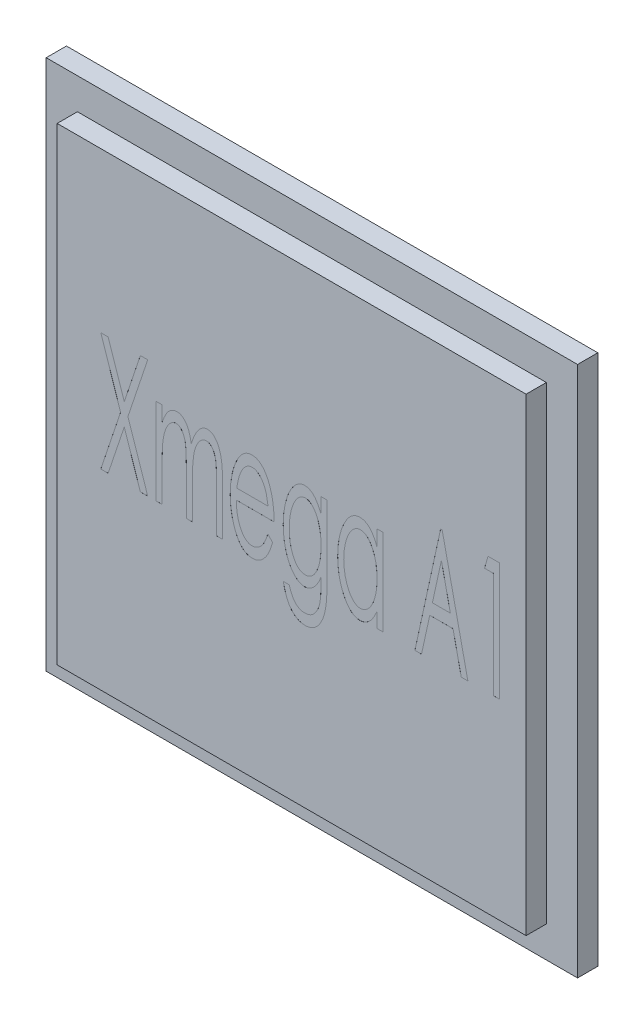
from build123d import *

# Parameters (mm, degrees)
SKICA1_W                 = 13.9
SKICA1_H                 = 13.9
P_IDAT_VYSUNUT_M1_DEPTH  = 1.2
ODEBRAT_VYSUNUT_M1_DEPTH = 0.001
SKICA4_W                 = 15.75
SKICA4_H                 = 15.75
SKICA4_W_2               = 13.9
SKICA4_H_2               = 13.9
P_IDAT_VYSUNUT_M3_DEPTH  = 0.6


with BuildPart() as part:
    # Skica1 → Přidat vysunutím1 (new body)
    with BuildSketch(Plane.XY):
        Rectangle(SKICA1_W, SKICA1_H)
    extrude(amount=P_IDAT_VYSUNUT_M1_DEPTH)

    # Skica2 → Odebrat vysunutím1 (cut)
    # profile 1 of 7: a face of its own
    with BuildSketch(Plane.XY.offset(1.2)):
        Polygon((-5.657339525, 2.224423239), (-5.439290647, 2.224423239), (-4.961826704, 0.799743751), (-4.484362762, 2.224423239), (-4.266313884, 2.224423239), (-4.852451704, 0.474423239), (-4.266313884, -1.275576761), (-4.484362762, -1.275576761), (-4.961826704, 0.149102726), (-5.439290647, -1.275576761), (-5.657339525, -1.275576761), (-5.070500583, 0.474423239), align=None)
    # profile 2 of 7: a face of its own
    with BuildSketch(Plane.XY.offset(1.2)):
        with BuildLine():
            Line((-4.019519012, 1.282115546), (-3.840031833, 1.282115546))
            Line((-3.840031833, 1.282115546), (-3.840031833, 0.837604328))
            add(Edge.make_bspline(
                [(-3.840031833, 0.837604328), (-3.825894466, 0.876177676), (-3.799336233, 0.948640953), (-3.753371331, 1.04665495), (-3.708878302, 1.129507622), (-3.674372124, 1.175873554), (-3.658441288, 1.197279809)],
                knots=[0, 0, 0, 0, 1.217816216, 2.287770118, 3.209496512, 4, 4, 4, 4], degree=3))
            add(Edge.make_bspline(
                [(-3.658441288, 1.197279809), (-3.63759457, 1.217028599), (-3.59781794, 1.254710324), (-3.53027268, 1.296083888), (-3.460411369, 1.321741182), (-3.412782742, 1.325250513), (-3.389210519, 1.326987341)],
                knots=[0, 0, 0, 0, 1.120991578, 2.138910614, 3.078914958, 4, 4, 4, 4], degree=3))
            add(Edge.make_bspline(
                [(-3.389210519, 1.326987341), (-3.373475752, 1.325898128), (-3.341698894, 1.323698429), (-3.2947333, 1.310162074), (-3.249879156, 1.285928981), (-3.206685171, 1.253537508), (-3.165837036, 1.213845973), (-3.128293998, 1.167823416), (-3.095242019, 1.11551161), (-3.066321996, 1.055807911), (-3.03903517, 0.987090192), (-3.015138114, 0.906270274), (-2.992715126, 0.812374405), (-2.980142298, 0.745121675), (-2.973445294, 0.70929904)],
                knots=[0, 0, 0, 0, 0.70497467, 1.423718626, 2.167988911, 2.97590154, 3.834418343, 4.712110969, 5.629520406, 6.598314936, 7.678802742, 8.936786955, 10.368358232, 12, 12, 12, 12], degree=3))
            add(Edge.make_bspline(
                [(-2.973445294, 0.70929904), (-2.959218782, 0.756982823), (-2.932245592, 0.847390348), (-2.88267354, 0.972275962), (-2.827548523, 1.07894444), (-2.76766526, 1.167639393), (-2.70294897, 1.237516157), (-2.635397876, 1.288822957), (-2.563841792, 1.321050295), (-2.514504009, 1.32503727), (-2.490372377, 1.326987341)],
                knots=[0, 0, 0, 0, 1.430898735, 2.712956173, 3.858598611, 4.878593333, 5.782223817, 6.584917614, 7.307868261, 8, 8, 8, 8], degree=3))
            add(Edge.make_bspline(
                [(-2.490372377, 1.326987341), (-2.46819168, 1.325297807), (-2.423626211, 1.321903193), (-2.359219648, 1.295988331), (-2.300987539, 1.251806236), (-2.247160101, 1.19283831), (-2.198283844, 1.119587341), (-2.156560774, 1.032560304), (-2.121716514, 0.932521707), (-2.09838612, 0.840101313), (-2.082898081, 0.757427487), (-2.07237125, 0.686823277), (-2.064261103, 0.608662875), (-2.057285794, 0.523336331), (-2.051787686, 0.430529991), (-2.047428831, 0.330263669), (-2.045590712, 0.222493878), (-2.045306566, 0.148168207), (-2.045160038, 0.109839905)],
                knots=[0, 0, 0, 0, 0.756463087, 1.519885966, 2.330984414, 3.234758128, 4.235496569, 5.327959897, 6.52219358, 7.848426635, 8.57957358, 9.394668963, 10.285911105, 11.263066096, 12.318715349, 13.461245202, 14.690813573, 16, 16, 16, 16], degree=3))
            Line((-2.045160038, 0.109839905), (-2.045160038, -1.275576761))
            Line((-2.045160038, -1.275576761), (-2.224647217, -1.275576761))
            Line((-2.224647217, -1.275576761), (-2.224647217, 0.111242149))
            add(Edge.make_bspline(
                [(-2.224647217, 0.111242149), (-2.224817833, 0.143961908), (-2.225145674, 0.206833442), (-2.226619023, 0.29704584), (-2.228409986, 0.37933643), (-2.232031997, 0.453422364), (-2.236234622, 0.519567169), (-2.24079131, 0.577840011), (-2.247111541, 0.628099002), (-2.256134461, 0.683561692), (-2.270920334, 0.744285885), (-2.292639363, 0.810468988), (-2.321066527, 0.868896955), (-2.354238568, 0.918936119), (-2.391202109, 0.96082324), (-2.433054395, 0.990806828), (-2.47899912, 1.010040289), (-2.511222529, 1.011928894), (-2.527531833, 1.012884777)],
                knots=[0, 0, 0, 0, 1.51836297, 2.917558436, 4.186860745, 5.337727298, 6.359248196, 7.262593179, 8.049522409, 8.709208536, 9.869236563, 10.946135496, 11.935605254, 12.874073121, 13.726161472, 14.511594637, 15.246670199, 16, 16, 16, 16], degree=3))
            add(Edge.make_bspline(
                [(-2.527531833, 1.012884777), (-2.547710855, 1.01134642), (-2.588921681, 1.008204693), (-2.647228539, 0.978515454), (-2.70235493, 0.933516605), (-2.752975383, 0.871380744), (-2.799664925, 0.795771972), (-2.839517541, 0.707285215), (-2.871725884, 0.607185277), (-2.894326091, 0.515532916), (-2.907540724, 0.432727759), (-2.91767075, 0.359869833), (-2.924940208, 0.277016962), (-2.930985944, 0.184428283), (-2.936986072, 0.082088741), (-2.940043076, -0.03013553), (-2.942257384, -0.152136666), (-2.942480217, -0.236746668), (-2.942595935, -0.280684934)],
                knots=[0, 0, 0, 0, 0.660002353, 1.34789691, 2.107969646, 2.991979148, 3.96914392, 5.025409628, 6.175424129, 7.424845589, 8.126354717, 8.933170354, 9.844345944, 10.861583212, 11.98578703, 13.216546376, 14.554542928, 16, 16, 16, 16], degree=3))
            Line((-2.942595935, -0.280684934), (-2.942595935, -1.275576761))
            Line((-2.942595935, -1.275576761), (-3.122083115, -1.275576761))
            Line((-3.122083115, -1.275576761), (-3.122083115, 0.025004168))
            add(Edge.make_bspline(
                [(-3.122083115, 0.025004168), (-3.122261522, 0.061696657), (-3.122604711, 0.132279648), (-3.123977044, 0.233478943), (-3.126080332, 0.325564801), (-3.12869218, 0.408317969), (-3.132558487, 0.481760734), (-3.138757355, 0.545946346), (-3.143510917, 0.601046181), (-3.153119517, 0.66099364), (-3.166250626, 0.726551738), (-3.189722025, 0.79685332), (-3.217379598, 0.859388589), (-3.250991808, 0.912683928), (-3.288431668, 0.957055374), (-3.330760701, 0.989497496), (-3.377582116, 1.009178718), (-3.410067932, 1.01164643), (-3.426369974, 1.012884777)],
                knots=[0, 0, 0, 0, 1.574861193, 3.029459675, 4.343833698, 5.52814318, 6.583091089, 7.499410718, 8.295893451, 8.955563666, 10.104512628, 11.160794949, 12.130411979, 13.03206512, 13.856786337, 14.609093303, 15.302014803, 16, 16, 16, 16], degree=3))
            add(Edge.make_bspline(
                [(-3.426369974, 1.012884777), (-3.445589885, 1.011238905), (-3.485285758, 1.0078396), (-3.542013777, 0.979110921), (-3.595870075, 0.935017332), (-3.646407022, 0.874730588), (-3.69299365, 0.800749221), (-3.732255252, 0.713534908), (-3.767049287, 0.615471758), (-3.789084506, 0.524792977), (-3.803642279, 0.444243231), (-3.813448547, 0.375014818), (-3.821624191, 0.298069945), (-3.828825924, 0.213465912), (-3.833149517, 0.121073925), (-3.837829033, 0.021306814), (-3.839590388, -0.086468188), (-3.839881037, -0.160793178), (-3.840031833, -0.199354806)],
                knots=[0, 0, 0, 0, 0.667901347, 1.379451074, 2.174339452, 3.088250632, 4.111091931, 5.216854925, 6.419016473, 7.738532864, 8.468087668, 9.275556869, 10.178113764, 11.168435705, 12.23848396, 13.405914129, 14.654124622, 16, 16, 16, 16], degree=3))
            Line((-3.840031833, -0.199354806), (-3.840031833, -1.275576761))
            Line((-3.840031833, -1.275576761), (-4.019519012, -1.275576761))
            Line((-4.019519012, -1.275576761), (-4.019519012, 1.282115546))
        make_face()
    # profile 3 of 7: a face of its own
    with BuildSketch(Plane.XY.offset(1.2)):
        with BuildLine():
            Line((-0.703914044, -0.467884454), (-0.564390807, -0.614418909))
            add(Edge.make_bspline(
                [(-0.564390807, -0.614418909), (-0.575703412, -0.653562624), (-0.597339871, -0.728428797), (-0.63433389, -0.834273223), (-0.674633578, -0.92801527), (-0.717757801, -1.010149823), (-0.762626683, -1.082167519), (-0.811445412, -1.143843245), (-0.861763258, -1.198081776), (-0.915909252, -1.242570484), (-0.973205099, -1.277497436), (-1.034110299, -1.302705414), (-1.098857585, -1.317658708), (-1.143440831, -1.319512485), (-1.165953307, -1.320448556)],
                knots=[0, 0, 0, 0, 1.469774626, 2.811087318, 4.042166936, 5.147176912, 6.155303339, 7.098135502, 7.980804388, 8.819619538, 9.617788822, 10.392823073, 11.188450055, 12, 12, 12, 12], degree=3))
            add(Edge.make_bspline(
                [(-1.165953307, -1.320448556), (-1.191081157, -1.319273375), (-1.240674319, -1.316953999), (-1.312543134, -1.297313706), (-1.379742059, -1.264914013), (-1.442700778, -1.220047785), (-1.501204892, -1.162307455), (-1.55523564, -1.092057737), (-1.604961683, -1.00935605), (-1.649374152, -0.915500266), (-1.689490811, -0.814180702), (-1.724316012, -0.707995044), (-1.754942704, -0.598689612), (-1.778227282, -0.485641205), (-1.797164693, -0.369859203), (-1.811619183, -0.250849539), (-1.818964509, -0.128402618), (-1.820184633, -0.045583593), (-1.820801063, -0.003741825)],
                knots=[0, 0, 0, 0, 0.751038303, 1.482274219, 2.211198371, 2.973871351, 3.785035177, 4.662261782, 5.619491828, 6.667478129, 7.76628157, 8.878823215, 10.010633725, 11.161560532, 12.33097756, 13.521271466, 14.747698584, 16, 16, 16, 16], degree=3))
            add(Edge.make_bspline(
                [(-1.820801063, -0.003741825), (-1.820451152, 0.035530981), (-1.819759081, 0.113206608), (-1.812629117, 0.228083454), (-1.80058701, 0.339858107), (-1.784537206, 0.448401521), (-1.764441921, 0.553792624), (-1.73901992, 0.65578934), (-1.709140619, 0.754587357), (-1.68534636, 0.818553821), (-1.673565486, 0.850224521)],
                knots=[0, 0, 0, 0, 1.081354805, 2.138755058, 3.167849101, 4.176290871, 5.159507986, 6.121001866, 7.069681469, 8, 8, 8, 8], degree=3))
            add(Edge.make_bspline(
                [(-1.673565486, 0.850224521), (-1.658060862, 0.887659511), (-1.628427696, 0.959207017), (-1.576424027, 1.057002611), (-1.518979101, 1.139183671), (-1.459133336, 1.20788406), (-1.393445003, 1.260676362), (-1.324414716, 1.299723822), (-1.250055837, 1.32230525), (-1.199284137, 1.325417138), (-1.173665647, 1.326987341)],
                knots=[0, 0, 0, 0, 1.322197472, 2.527045748, 3.606318956, 4.589521203, 5.490186208, 6.34374623, 7.164284008, 8, 8, 8, 8], degree=3))
            add(Edge.make_bspline(
                [(-1.173665647, 1.326987341), (-1.147293296, 1.325611453), (-1.094834376, 1.322874586), (-1.018859798, 1.297224829), (-0.947144326, 1.257330145), (-0.879700817, 1.201513955), (-0.817890726, 1.129026813), (-0.76014333, 1.041310044), (-0.705062844, 0.93874797), (-0.674870088, 0.8631909), (-0.659042249, 0.823581893)],
                knots=[0, 0, 0, 0, 0.823440567, 1.637957963, 2.48296191, 3.382350809, 4.36252078, 5.454315555, 6.665485104, 8, 8, 8, 8], degree=3))
            add(Edge.make_bspline(
                [(-0.659042249, 0.823581893), (-0.647936141, 0.793084861), (-0.625336883, 0.731027992), (-0.597444207, 0.633569263), (-0.573808184, 0.530793379), (-0.554244871, 0.422461289), (-0.538615967, 0.308806239), (-0.528745757, 0.189425708), (-0.521275269, 0.064591898), (-0.520112688, -0.020556837), (-0.519519012, -0.0640383)],
                knots=[0, 0, 0, 0, 0.862103675, 1.754251248, 2.691108883, 3.663011642, 4.678144778, 5.737819903, 6.844810799, 8, 8, 8, 8], degree=3))
            Line((-0.519519012, -0.0640383), (-1.641313884, -0.0640383))
            add(Edge.make_bspline(
                [(-1.641313884, -0.0640383), (-1.640803821, -0.097714288), (-1.639803588, -0.163752978), (-1.631148848, -0.260241083), (-1.621674928, -0.352403117), (-1.605618767, -0.439294631), (-1.587344657, -0.521989067), (-1.562915751, -0.59935118), (-1.536809806, -0.673131949), (-1.505413281, -0.740932881), (-1.471336883, -0.802676508), (-1.435039114, -0.856700597), (-1.397212114, -0.902995928), (-1.357024826, -0.940678845), (-1.314589971, -0.970109196), (-1.269667013, -0.990544252), (-1.223044866, -1.003961143), (-1.191048797, -1.00555161), (-1.17506789, -1.006345992)],
                knots=[0, 0, 0, 0, 1.414313561, 2.773472163, 4.06801243, 5.30443612, 6.48331242, 7.623069609, 8.710148246, 9.768882371, 10.757758178, 11.669971891, 12.499622512, 13.26377558, 13.977242447, 14.658150177, 15.329793424, 16, 16, 16, 16], degree=3))
            add(Edge.make_bspline(
                [(-1.17506789, -1.006345992), (-1.159343284, -1.005716694), (-1.127724296, -1.004451303), (-1.080853856, -0.992578), (-1.034996495, -0.973324984), (-0.990255841, -0.947072898), (-0.946908891, -0.915445219), (-0.907909106, -0.876794062), (-0.871028971, -0.834770405), (-0.836902929, -0.786049413), (-0.804630369, -0.726596672), (-0.771593388, -0.654150592), (-0.737101524, -0.566340442), (-0.715530636, -0.502346938), (-0.703914044, -0.467884454)],
                knots=[0, 0, 0, 0, 0.738465075, 1.484903234, 2.258522336, 3.071061432, 3.91960142, 4.774665461, 5.647350008, 6.546892649, 7.56535417, 8.824326256, 10.289801275, 12, 12, 12, 12], degree=3))
        make_face()
        with BuildLine():
            add(Edge.make_bspline(
                [(-0.699006192, 0.250064264), (-0.704758733, 0.29147865), (-0.715682561, 0.370122787), (-0.7362076, 0.481264656), (-0.76126769, 0.578964787), (-0.790139229, 0.664626389), (-0.82338067, 0.740005768), (-0.861115389, 0.807350786), (-0.904824747, 0.866396473), (-0.952317269, 0.91737961), (-1.001943409, 0.96041784), (-1.055420442, 0.989750227), (-1.109602511, 1.009980028), (-1.146852102, 1.011924347), (-1.165252185, 1.012884777)],
                knots=[0, 0, 0, 0, 1.557983534, 2.958543775, 4.20899479, 5.313354295, 6.323151934, 7.274795459, 8.184011725, 9.052834006, 9.869040623, 10.617635379, 11.317156976, 12, 12, 12, 12], degree=3))
            add(Edge.make_bspline(
                [(-1.165252185, 1.012884777), (-1.180274467, 1.012256249), (-1.210280707, 1.011000796), (-1.25429857, 0.999375818), (-1.296191498, 0.979603764), (-1.337472891, 0.953838113), (-1.375511306, 0.918806909), (-1.412675499, 0.877312714), (-1.448210888, 0.828477195), (-1.46918106, 0.792011616), (-1.480055871, 0.773101123)],
                knots=[0, 0, 0, 0, 0.865497469, 1.728786899, 2.60358039, 3.531120603, 4.52424669, 5.574483609, 6.742164244, 8, 8, 8, 8], degree=3))
            add(Edge.make_bspline(
                [(-1.480055871, 0.773101123), (-1.487992182, 0.757781916), (-1.504557513, 0.725806387), (-1.525813537, 0.673821011), (-1.546280056, 0.616778343), (-1.565214408, 0.554060065), (-1.58238774, 0.485677258), (-1.598720628, 0.412102229), (-1.612461385, 0.33293054), (-1.620842839, 0.278357083), (-1.625188083, 0.250064264)],
                knots=[0, 0, 0, 0, 0.758823364, 1.583879516, 2.4686208, 3.425043348, 4.465103222, 5.570473885, 6.74044733, 8, 8, 8, 8], degree=3))
            Line((-1.625188083, 0.250064264), (-0.699006192, 0.250064264))
        make_face(mode=Mode.SUBTRACT)
    # profile 4 of 7: a face of its own
    with BuildSketch(Plane.XY.offset(1.2)):
        with BuildLine():
            Line((0.871506629, 1.282115546), (1.050993808, 1.282115546))
            Line((1.050993808, 1.282115546), (1.050993808, -0.74763205))
            add(Edge.make_bspline(
                [(1.050993808, -0.74763205), (1.050866885, -0.790868627), (1.050621942, -0.874309061), (1.048543153, -0.994915571), (1.045009802, -1.106400525), (1.040532879, -1.209061163), (1.033094846, -1.302498212), (1.02597323, -1.387229682), (1.016030443, -1.462695197), (1.00833072, -1.510001863), (1.00471977, -1.532187338)],
                knots=[0, 0, 0, 0, 1.318820306, 2.545135331, 3.67915165, 4.721130733, 5.679026657, 6.538051681, 7.314387987, 8, 8, 8, 8], degree=3))
            add(Edge.make_bspline(
                [(1.00471977, -1.532187338), (0.999169073, -1.56076444), (0.988375415, -1.616334299), (0.967747185, -1.69652344), (0.945022781, -1.771885446), (0.917985541, -1.841807121), (0.889623684, -1.907532066), (0.857318916, -1.968074343), (0.821569015, -2.023157076), (0.783827703, -2.073504785), (0.743004271, -2.117433697), (0.70076794, -2.156672052), (0.656251073, -2.189713332), (0.609001954, -2.215678028), (0.560697383, -2.237300345), (0.509666798, -2.251699256), (0.456813774, -2.26140957), (0.420730105, -2.262303522), (0.402456148, -2.262756249)],
                knots=[0, 0, 0, 0, 1.355418986, 2.635692135, 3.854389296, 5.01870456, 6.124899907, 7.186394014, 8.209821136, 9.180680549, 10.112694706, 10.998574117, 11.862793917, 12.686304931, 13.505199978, 14.321487072, 15.149945865, 16, 16, 16, 16], degree=3))
            add(Edge.make_bspline(
                [(0.402456148, -2.262756249), (0.37591477, -2.261879298), (0.323574548, -2.260149931), (0.247783847, -2.240288802), (0.175135156, -2.212323901), (0.108618738, -2.16974539), (0.047049149, -2.11872216), (-0.008616342, -2.059077896), (-0.058904626, -1.992104742), (-0.103158544, -1.914730986), (-0.143521098, -1.824511104), (-0.180741546, -1.717520796), (-0.218083927, -1.592966981), (-0.239122605, -1.502876643), (-0.250288243, -1.455063941)],
                knots=[0, 0, 0, 0, 0.843561991, 1.663524092, 2.48213256, 3.314877722, 4.166291231, 5.024968053, 5.908125656, 6.828997618, 7.858799374, 9.052960854, 10.435948785, 12, 12, 12, 12], degree=3))
            Line((-0.250288243, -1.455063941), (-0.070801063, -1.455063941))
            add(Edge.make_bspline(
                [(-0.070801063, -1.455063941), (-0.059014883, -1.494624642), (-0.036757302, -1.569332939), (0.007491569, -1.670830594), (0.054118506, -1.757579544), (0.107804383, -1.827796552), (0.167959411, -1.882283593), (0.235193607, -1.921133502), (0.309825561, -1.944317452), (0.361862593, -1.947187951), (0.388433712, -1.948653684)],
                knots=[0, 0, 0, 0, 1.35704034, 2.562699064, 3.636786972, 4.590486618, 5.45647129, 6.290132021, 7.126908194, 8, 8, 8, 8], degree=3))
            add(Edge.make_bspline(
                [(0.388433712, -1.948653684), (0.414786327, -1.947227324), (0.466171558, -1.944446051), (0.539918614, -1.920788287), (0.606846554, -1.882350849), (0.665789974, -1.828583483), (0.716855093, -1.763986557), (0.761539876, -1.691399924), (0.797029355, -1.610558039), (0.820729914, -1.537263223), (0.835206629, -1.471916726), (0.844961583, -1.414821023), (0.853169253, -1.350250199), (0.860333811, -1.278259285), (0.864631443, -1.198705951), (0.869339017, -1.111797351), (0.871055138, -1.017336685), (0.871352602, -0.951891999), (0.871506629, -0.918004646)],
                knots=[0, 0, 0, 0, 0.998105433, 1.946215894, 2.907672558, 3.906408257, 4.953549365, 6.024384952, 7.132014055, 8.296015282, 8.941504227, 9.670543261, 10.493401367, 11.41120185, 12.415318009, 13.516358581, 14.713966883, 16, 16, 16, 16], degree=3))
            Line((0.871506629, -0.918004646), (0.871506629, -0.785492627))
            add(Edge.make_bspline(
                [(0.871506629, -0.785492627), (0.856498784, -0.822937868), (0.827717004, -0.894749693), (0.775962539, -0.993565649), (0.718429634, -1.078200059), (0.656831872, -1.14899355), (0.591773758, -1.205337509), (0.523384079, -1.245400907), (0.452642667, -1.271248043), (0.404064891, -1.274143561), (0.380020251, -1.275576761)],
                knots=[0, 0, 0, 0, 1.314748708, 2.5214019, 3.628895984, 4.643926502, 5.573750358, 6.420630553, 7.218256304, 8, 8, 8, 8], degree=3))
            add(Edge.make_bspline(
                [(0.380020251, -1.275576761), (0.365952147, -1.275052088), (0.337798442, -1.274002088), (0.296193154, -1.264992275), (0.254972446, -1.251613602), (0.214339883, -1.232756852), (0.17471987, -1.207518837), (0.135651572, -1.177610182), (0.09751541, -1.141842989), (0.046288687, -1.087005947), (-0.012552253, -1.006123313), (-0.074314753, -0.895879007), (-0.127536253, -0.770738881), (-0.17147751, -0.6318511), (-0.207044948, -0.482116114), (-0.231752568, -0.323867937), (-0.247837474, -0.158555902), (-0.249460021, -0.04584825), (-0.250288243, 0.011682854)],
                knots=[0, 0, 0, 0, 0.434456053, 0.869452438, 1.310407954, 1.772631978, 2.249748752, 2.759859205, 3.291564481, 3.864111903, 5.07791605, 6.371959389, 7.763666543, 9.273946478, 10.870403439, 12.516681407, 14.221956006, 16, 16, 16, 16], degree=3))
            add(Edge.make_bspline(
                [(-0.250288243, 0.011682854), (-0.249118747, 0.069440214), (-0.246818158, 0.183058382), (-0.231388326, 0.35061535), (-0.204782431, 0.512030145), (-0.167873396, 0.665937464), (-0.122766715, 0.809335056), (-0.068189362, 0.938353298), (-0.005714599, 1.051729697), (0.053682558, 1.134499839), (0.105512504, 1.190348157), (0.142867872, 1.227695016), (0.182689984, 1.257385829), (0.221533075, 1.283235327), (0.261763411, 1.302419661), (0.302164168, 1.316451909), (0.343410309, 1.325383316), (0.371096084, 1.326452946), (0.384928103, 1.326987341)],
                knots=[0, 0, 0, 0, 1.757457697, 3.457206575, 5.115021533, 6.731222701, 8.269540472, 9.684225446, 10.986248687, 12.202395668, 12.771181053, 13.30430527, 13.806408291, 14.279843038, 14.721957786, 15.158257633, 15.579459265, 16, 16, 16, 16], degree=3))
            add(Edge.make_bspline(
                [(0.384928103, 1.326987341), (0.407506786, 1.325556964), (0.453097461, 1.322668758), (0.519690122, 1.301437774), (0.583463095, 1.266488185), (0.645622107, 1.217821464), (0.705565064, 1.15094468), (0.76325788, 1.064291839), (0.819612223, 0.957026244), (0.853427176, 0.877382205), (0.871506629, 0.834799841)],
                knots=[0, 0, 0, 0, 0.73630153, 1.48673351, 2.258121053, 3.100478171, 4.050835266, 5.176476774, 6.490379275, 8, 8, 8, 8], degree=3))
            Line((0.871506629, 0.834799841), (0.871506629, 1.282115546))
        make_face()
        with BuildLine():
            add(Edge.make_bspline(
                [(0.41086961, 1.012884777), (0.389344549, 1.011246413), (0.345522632, 1.007910939), (0.282414617, 0.980200242), (0.221585479, 0.937762911), (0.165141066, 0.878043427), (0.111737981, 0.805009954), (0.065108213, 0.717942982), (0.024836969, 0.618331554), (-0.009960751, 0.507736343), (-0.036496227, 0.388240964), (-0.056212817, 0.262737808), (-0.068295097, 0.132511716), (-0.06995796, 0.043960035), (-0.070801063, -0.000937338)],
                knots=[0, 0, 0, 0, 0.636250911, 1.295315044, 2.01254279, 2.826249826, 3.719129284, 4.690021072, 5.746858626, 6.902218818, 8.124746115, 9.373771402, 10.668452556, 12, 12, 12, 12], degree=3))
            add(Edge.make_bspline(
                [(-0.070801063, -0.000937338), (-0.070442151, -0.034838494), (-0.069738532, -0.101299081), (-0.06290249, -0.198789725), (-0.053979873, -0.291851624), (-0.038436128, -0.38011062), (-0.021106803, -0.464231881), (0.00265206, -0.543566858), (0.028831632, -0.618760688), (0.059535018, -0.688626726), (0.093484177, -0.751960173), (0.12964403, -0.807702102), (0.168688074, -0.855040695), (0.210412923, -0.89358359), (0.254862936, -0.92382011), (0.301266355, -0.945984845), (0.350795258, -0.959133296), (0.38461737, -0.960686957), (0.401755026, -0.961474197)],
                knots=[0, 0, 0, 0, 1.393096984, 2.73105864, 4.015649683, 5.233164621, 6.412571026, 7.543331699, 8.634011847, 9.68343302, 10.676198584, 11.584668582, 12.409904306, 13.191736156, 13.911059939, 14.611472212, 15.296433293, 16, 16, 16, 16], degree=3))
            add(Edge.make_bspline(
                [(0.401755026, -0.961474197), (0.419127889, -0.960693544), (0.453413663, -0.959152906), (0.503292562, -0.945993351), (0.550294981, -0.924438736), (0.594816921, -0.894892373), (0.635922272, -0.855664086), (0.674990838, -0.809020644), (0.710669578, -0.753313516), (0.744208952, -0.69058104), (0.773815435, -0.620469547), (0.800757, -0.545031057), (0.821905806, -0.463930063), (0.840528337, -0.378163548), (0.85403508, -0.286776396), (0.864939081, -0.190237165), (0.870115098, -0.088166833), (0.871034759, -0.01846934), (0.871506629, 0.017291828)],
                knots=[0, 0, 0, 0, 0.701945407, 1.385306606, 2.070757599, 2.786636731, 3.535889841, 4.361487886, 5.242605014, 6.206986587, 7.236162425, 8.318635116, 9.444739657, 10.624119031, 11.867693461, 13.180130022, 14.553149586, 16, 16, 16, 16], degree=3))
            add(Edge.make_bspline(
                [(0.871506629, 0.017291828), (0.870931228, 0.063824061), (0.86981332, 0.15422848), (0.858351818, 0.286080758), (0.839721891, 0.410010577), (0.813710214, 0.525673919), (0.782476791, 0.632130785), (0.743006488, 0.727076913), (0.698427814, 0.810791988), (0.647628216, 0.881712995), (0.592452519, 0.938913661), (0.535048251, 0.981736242), (0.473657909, 1.007635296), (0.43165816, 1.011146729), (0.41086961, 1.012884777)],
                knots=[0, 0, 0, 0, 1.411533107, 2.742374965, 4.011981541, 5.211034617, 6.337125629, 7.373488251, 8.325359796, 9.209022813, 10.011328485, 10.727649109, 11.370226471, 12, 12, 12, 12], degree=3))
        make_face(mode=Mode.SUBTRACT)
    # profile 5 of 7: a face of its own
    with BuildSketch(Plane.XY.offset(1.2)):
        with BuildLine():
            Line((2.711250219, 1.282115546), (2.711250219, -1.275576761))
            Line((2.711250219, -1.275576761), (2.531763039, -1.275576761))
            Line((2.531763039, -1.275576761), (2.531763039, -0.833168909))
            add(Edge.make_bspline(
                [(2.531763039, -0.833168909), (2.514653693, -0.872738152), (2.482259296, -0.947657539), (2.426248199, -1.049450437), (2.366789229, -1.134382174), (2.30414273, -1.203265698), (2.23733622, -1.25552618), (2.16757027, -1.29253849), (2.094691062, -1.316876159), (2.044436467, -1.319255669), (2.019243007, -1.320448556)],
                knots=[0, 0, 0, 0, 1.376809071, 2.606814916, 3.704840143, 4.68230614, 5.570980294, 6.39935724, 7.197571305, 8, 8, 8, 8], degree=3))
            add(Edge.make_bspline(
                [(2.019243007, -1.320448556), (1.996909422, -1.31921546), (1.952425725, -1.316759399), (1.887388679, -1.297342665), (1.825041516, -1.266867171), (1.765389056, -1.223701936), (1.708619052, -1.168447904), (1.654716774, -1.100933025), (1.602615208, -1.021983351), (1.55466984, -0.931507115), (1.510107005, -0.833019746), (1.471596485, -0.727939089), (1.438686528, -0.617638497), (1.411352892, -0.502028172), (1.39034698, -0.381211446), (1.375986341, -0.255251632), (1.366437829, -0.124249027), (1.365548645, -0.03507606), (1.365096373, 0.01028061)],
                knots=[0, 0, 0, 0, 0.666089695, 1.326707355, 2.010376711, 2.730929822, 3.515855088, 4.369441671, 5.306456114, 6.337072726, 7.424284859, 8.532931352, 9.676877885, 10.860348837, 12.079071447, 13.337099347, 14.645550189, 16, 16, 16, 16], degree=3))
            add(Edge.make_bspline(
                [(1.365096373, 0.01028061), (1.365577985, 0.054699472), (1.36652706, 0.142232169), (1.375706309, 0.270973174), (1.3913662, 0.394931171), (1.411877302, 0.513985783), (1.439527751, 0.627894802), (1.472397994, 0.737109677), (1.511407441, 0.841498133), (1.556688992, 0.939538903), (1.605724, 1.029153144), (1.657433412, 1.108411131), (1.711911331, 1.17550113), (1.769377308, 1.23043588), (1.828936657, 1.273928626), (1.89166962, 1.304939695), (1.957249175, 1.322999295), (2.001843354, 1.325657578), (2.02415086, 1.326987341)],
                knots=[0, 0, 0, 0, 1.335371572, 2.631509953, 3.877835977, 5.090834958, 6.261684642, 7.399795486, 8.518279806, 9.609255011, 10.64392529, 11.587181553, 12.450895962, 13.236192212, 13.971349092, 14.659572638, 15.329473221, 16, 16, 16, 16], degree=3))
            add(Edge.make_bspline(
                [(2.02415086, 1.326987341), (2.049798883, 1.325517738), (2.100991076, 1.322584481), (2.175651578, 1.298119086), (2.245610407, 1.257896352), (2.312050453, 1.202474208), (2.374379906, 1.13001429), (2.431800548, 1.039443318), (2.486218864, 0.931214364), (2.515977592, 0.851266493), (2.531763039, 0.808858335)],
                knots=[0, 0, 0, 0, 0.79355211, 1.583890976, 2.407773762, 3.282349877, 4.252681915, 5.357713838, 6.598405581, 8, 8, 8, 8], degree=3))
            Line((2.531763039, 0.808858335), (2.531763039, 1.282115546))
            Line((2.531763039, 1.282115546), (2.711250219, 1.282115546))
        make_face()
        with BuildLine():
            add(Edge.make_bspline(
                [(2.038874417, 1.012884777), (2.016682565, 1.011200508), (1.971876588, 1.00779992), (1.906867699, 0.981378434), (1.845939547, 0.938382463), (1.787884497, 0.88054386), (1.734873697, 0.807273065), (1.686745798, 0.720889278), (1.644751392, 0.620832596), (1.60944766, 0.509468417), (1.579785697, 0.389891782), (1.560266204, 0.265042522), (1.546852389, 0.137007506), (1.545345544, 0.05051377), (1.544583552, 0.006775001)],
                knots=[0, 0, 0, 0, 0.656881251, 1.326261846, 2.049203523, 2.857974616, 3.745277556, 4.722888579, 5.785090279, 6.957883496, 8.185191643, 9.435327898, 10.703078354, 12, 12, 12, 12], degree=3))
            add(Edge.make_bspline(
                [(1.544583552, 0.006775001), (1.545378661, -0.036724921), (1.546955169, -0.12297471), (1.559966444, -0.25088519), (1.580987385, -0.375959675), (1.60970116, -0.496580654), (1.646539722, -0.608697477), (1.687942389, -0.709957729), (1.73637819, -0.797560122), (1.790063473, -0.871540457), (1.847481387, -0.930988539), (1.908435044, -0.973893488), (1.971951241, -1.001252461), (2.015961319, -1.00467376), (2.037472174, -1.006345992)],
                knots=[0, 0, 0, 0, 1.286766066, 2.551344847, 3.799484014, 5.037160291, 6.215732796, 7.288015557, 8.269217045, 9.169537055, 9.986063156, 10.701505158, 11.365333219, 12, 12, 12, 12], degree=3))
            add(Edge.make_bspline(
                [(2.037472174, -1.006345992), (2.059437223, -1.004653595), (2.104022036, -1.001218356), (2.168993689, -0.974473723), (2.231367744, -0.93202034), (2.290282279, -0.873166158), (2.345241884, -0.800926771), (2.394584916, -0.716310869), (2.435292211, -0.619351073), (2.470122228, -0.512162907), (2.498084058, -0.395451031), (2.517095191, -0.270666171), (2.529395754, -0.138836065), (2.530959999, -0.048642475), (2.531763039, -0.002339582)],
                knots=[0, 0, 0, 0, 0.649788265, 1.318944836, 2.053114612, 2.87635825, 3.775862624, 4.738542696, 5.77218038, 6.887575275, 8.077537979, 9.326160303, 10.627324677, 12, 12, 12, 12], degree=3))
            add(Edge.make_bspline(
                [(2.531763039, -0.002339582), (2.531442173, 0.032963856), (2.530812519, 0.102241766), (2.523418809, 0.203993692), (2.512477654, 0.301354051), (2.496959904, 0.394246671), (2.477625327, 0.482873756), (2.452988095, 0.566868358), (2.424363394, 0.646671547), (2.390964306, 0.720794995), (2.354848959, 0.788622763), (2.3167749, 0.848446384), (2.27591548, 0.898927453), (2.23272358, 0.940037791), (2.18793947, 0.973235431), (2.139917874, 0.995632435), (2.090288939, 1.010893226), (2.056047373, 1.012219579), (2.038874417, 1.012884777)],
                knots=[0, 0, 0, 0, 1.382476414, 2.712910757, 3.993671946, 5.218622704, 6.400119605, 7.544327924, 8.644673272, 9.718152906, 10.72559698, 11.652335086, 12.491532133, 13.262018601, 13.983476199, 14.663132088, 15.329529072, 16, 16, 16, 16], degree=3))
        make_face(mode=Mode.SUBTRACT)
    # profile 6 of 7: a face of its own
    with BuildSketch(Plane.XY.offset(1.2)):
        Polygon((4.461250219, 2.224423239), (5.224070731, -1.275576761), (5.027756629, -1.275576761), (4.783065123, -0.15378189), (4.09456352, -0.15378189), (3.849872014, -1.275576761), (3.653557911, -1.275576761), (4.416378424, 2.224423239), align=None)
        Polygon((4.438814321, 1.426546636), (4.172388039, 0.205192469), (4.704539481, 0.205192469), align=None, mode=Mode.SUBTRACT)
    # profile 7 of 7: a face of its own
    with BuildSketch(Plane.XY.offset(1.2)):
        Polygon((5.820024257, 2.224423239), (6.166378424, 2.224423239), (6.166378424, -1.275576761), (5.986891244, -1.275576761), (5.986891244, 1.86544888), (5.717660475, 1.86544888), align=None)
    extrude(amount=-ODEBRAT_VYSUNUT_M1_DEPTH, mode=Mode.SUBTRACT)

    # Skica4 → Přidat vysunutím3 (add)
    with BuildSketch(Plane.XY):
        Rectangle(SKICA4_W, SKICA4_H)
        Rectangle(SKICA4_W_2, SKICA4_H_2, mode=Mode.SUBTRACT)
    extrude(amount=P_IDAT_VYSUNUT_M3_DEPTH)


solid = part.part
